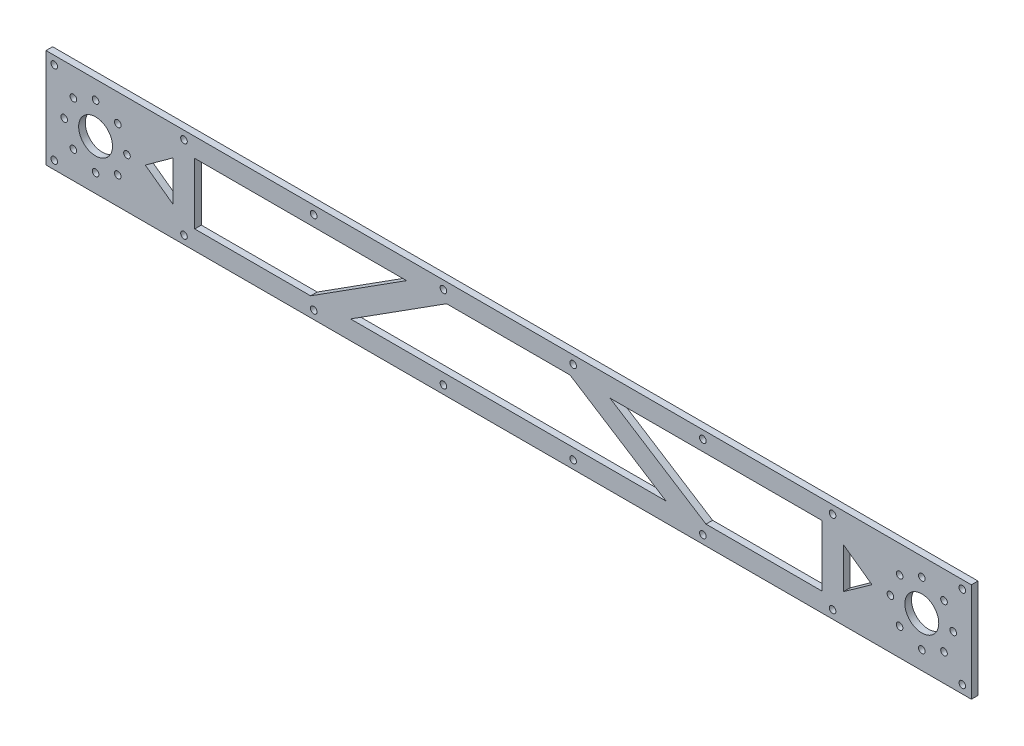
from build123d import *

# Parameters (mm, degrees)
SKETCH_1_W          = 560
SKETCH_1_H          = 60
SKETCH_1_R          = 10.25
SKETCH_1_R_2        = 2
EXTRUDE_1_DEPTH     = 4
SKETCH_2_R          = 2
CUT_EXTRUDE_1_DEPTH = 10
CUT_EXTRUDE_2_DEPTH = 10


with BuildPart() as part:
    # 草图1 → 凸台-拉伸1 (new body)
    with BuildSketch(Plane.XY):
        with Locations((250, 0)):
            Rectangle(SKETCH_1_W, SKETCH_1_H)
        Circle(SKETCH_1_R, mode=Mode.SUBTRACT)
        with Locations((0, -19)):
            Circle(SKETCH_1_R_2, mode=Mode.SUBTRACT)
        with Locations((-13.435028843, -13.435028843)):
            Circle(SKETCH_1_R_2, mode=Mode.SUBTRACT)
        with Locations((-19, 0)):
            Circle(SKETCH_1_R_2, mode=Mode.SUBTRACT)
        with Locations((-13.435028843, 13.435028843)):
            Circle(SKETCH_1_R_2, mode=Mode.SUBTRACT)
        with Locations((0, 19)):
            Circle(SKETCH_1_R_2, mode=Mode.SUBTRACT)
        with Locations((13.435028843, 13.435028843)):
            Circle(SKETCH_1_R_2, mode=Mode.SUBTRACT)
        with Locations((19, 0)):
            Circle(SKETCH_1_R_2, mode=Mode.SUBTRACT)
        with Locations((13.435028843, -13.435028843)):
            Circle(SKETCH_1_R_2, mode=Mode.SUBTRACT)
        with Locations((500, -19)):
            Circle(SKETCH_1_R_2, mode=Mode.SUBTRACT)
        with Locations((500, 0)):
            Circle(SKETCH_1_R, mode=Mode.SUBTRACT)
        with Locations((486.564971157, -13.435028843)):
            Circle(SKETCH_1_R_2, mode=Mode.SUBTRACT)
        with Locations((481, 0)):
            Circle(SKETCH_1_R_2, mode=Mode.SUBTRACT)
        with Locations((486.564971157, 13.435028843)):
            Circle(SKETCH_1_R_2, mode=Mode.SUBTRACT)
        with Locations((500, 19)):
            Circle(SKETCH_1_R_2, mode=Mode.SUBTRACT)
        with Locations((513.435028843, 13.435028843)):
            Circle(SKETCH_1_R_2, mode=Mode.SUBTRACT)
        with Locations((519, 0)):
            Circle(SKETCH_1_R_2, mode=Mode.SUBTRACT)
        with Locations((513.435028843, -13.435028843)):
            Circle(SKETCH_1_R_2, mode=Mode.SUBTRACT)
    extrude(amount=EXTRUDE_1_DEPTH)

    # 草图2 → 切除-拉伸1 (cut)
    with BuildSketch(Plane.XY.offset(4)):
        with Locations((-25, 25)):
            Circle(SKETCH_2_R)
        with Locations((53.5, 25)):
            Circle(SKETCH_2_R)
        with Locations((132, 25)):
            Circle(SKETCH_2_R)
        with Locations((210.5, 25)):
            Circle(SKETCH_2_R)
        with Locations((289, 25)):
            Circle(SKETCH_2_R)
        with Locations((367.5, 25)):
            Circle(SKETCH_2_R)
        with Locations((446, 25)):
            Circle(SKETCH_2_R)
        with Locations((524.5, 25)):
            Circle(SKETCH_2_R)
        with Locations((53.5, -25)):
            Circle(SKETCH_2_R)
        with Locations((132, -25)):
            Circle(SKETCH_2_R)
        with Locations((210.5, -25)):
            Circle(SKETCH_2_R)
        with Locations((289, -25)):
            Circle(SKETCH_2_R)
        with Locations((367.5, -25)):
            Circle(SKETCH_2_R)
        with Locations((446, -25)):
            Circle(SKETCH_2_R)
        with Locations((524.5, -25)):
            Circle(SKETCH_2_R)
        with Locations((-25, -25)):
            Circle(SKETCH_2_R)
    extrude(amount=-CUT_EXTRUDE_1_DEPTH, mode=Mode.SUBTRACT)

    # 草图3 → 切除-拉伸2 (cut)
    with BuildSketch(Plane.XY.offset(4)):
        Polygon((60, -18.5), (60, 18.5), (188.195742791, 18.5), (130.105742791, -18.5), align=None)
        Polygon((212.394257209, 18.5), (287.105742791, 18.5), (345.195742791, -18.5), (154.304257209, -18.5), align=None)
        Polygon((369.394257209, -18.5), (439.5, -18.5), (439.5, 18.5), (311.304257209, 18.5), align=None)
        Polygon((452.5, -12.369269395), (452.5, 12.369269395), (469.816977153, 0), align=None)
        Polygon((47, -12.262684635), (30.077495204, 0), (47, 12.262684635), align=None)
    extrude(amount=-CUT_EXTRUDE_2_DEPTH, mode=Mode.SUBTRACT)


solid = part.part
